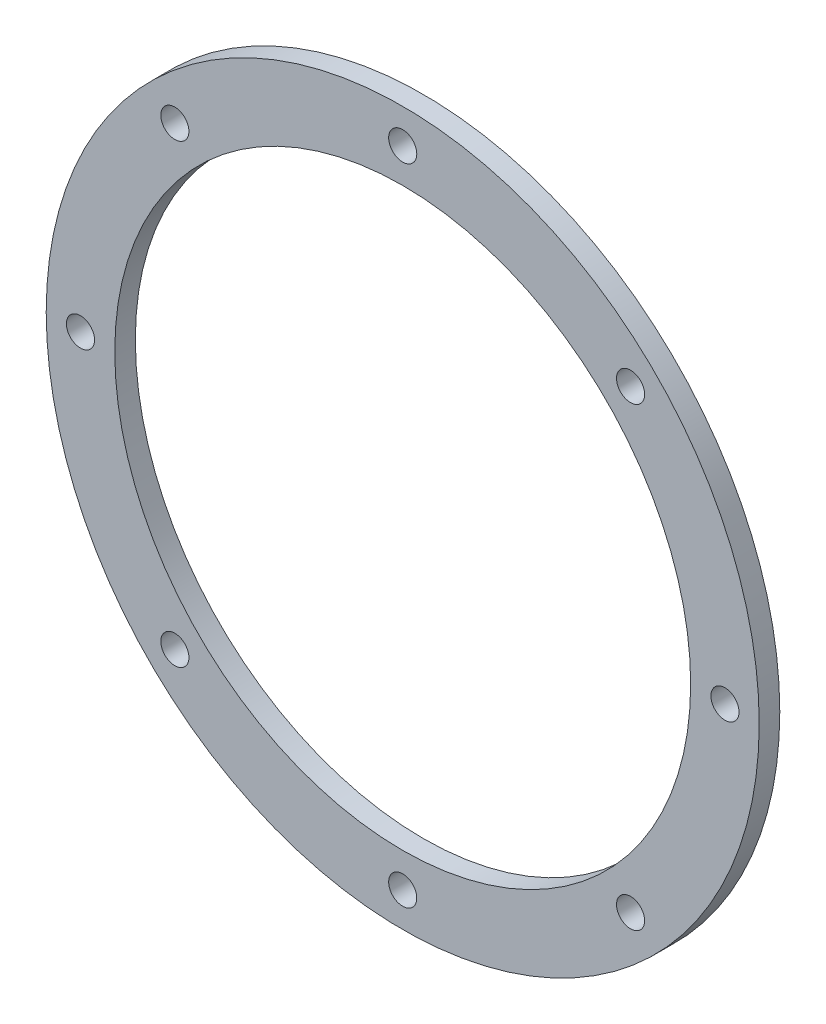
from build123d import *

# Parameters (mm, degrees)
SKETCH1_R           = 52
SKETCH1_R_2         = 42
BOSS_EXTRUDE1_DEPTH = 3
SKETCH2_R           = 2.05
CUT_EXTRUDE1_DEPTH  = 3
CIRPATTERN1_COUNT   = 8


with BuildPart() as part:
    # Sketch1 → Boss-Extrude1 (new body)
    with BuildSketch(Plane.XY):
        Circle(SKETCH1_R)
        Circle(SKETCH1_R_2, mode=Mode.SUBTRACT)
    extrude(amount=BOSS_EXTRUDE1_DEPTH)

    # Sketch2 → Cut-Extrude1 (cut)
    with BuildSketch(Plane.XY.offset(3)):
        with Locations((0, 47)):
            Circle(SKETCH2_R)
    cut_extrude1 = extrude(amount=-CUT_EXTRUDE1_DEPTH, mode=Mode.SUBTRACT)

    # CirPattern1: Cut-Extrude1 ×8 about axis
    cirpattern1_axis = Axis((0, 0, 0), (0, 0, 1))
    for i in range(1, CIRPATTERN1_COUNT):
        add(cut_extrude1.rotate(cirpattern1_axis, i * 360 / CIRPATTERN1_COUNT), mode=Mode.SUBTRACT)


solid = part.part
